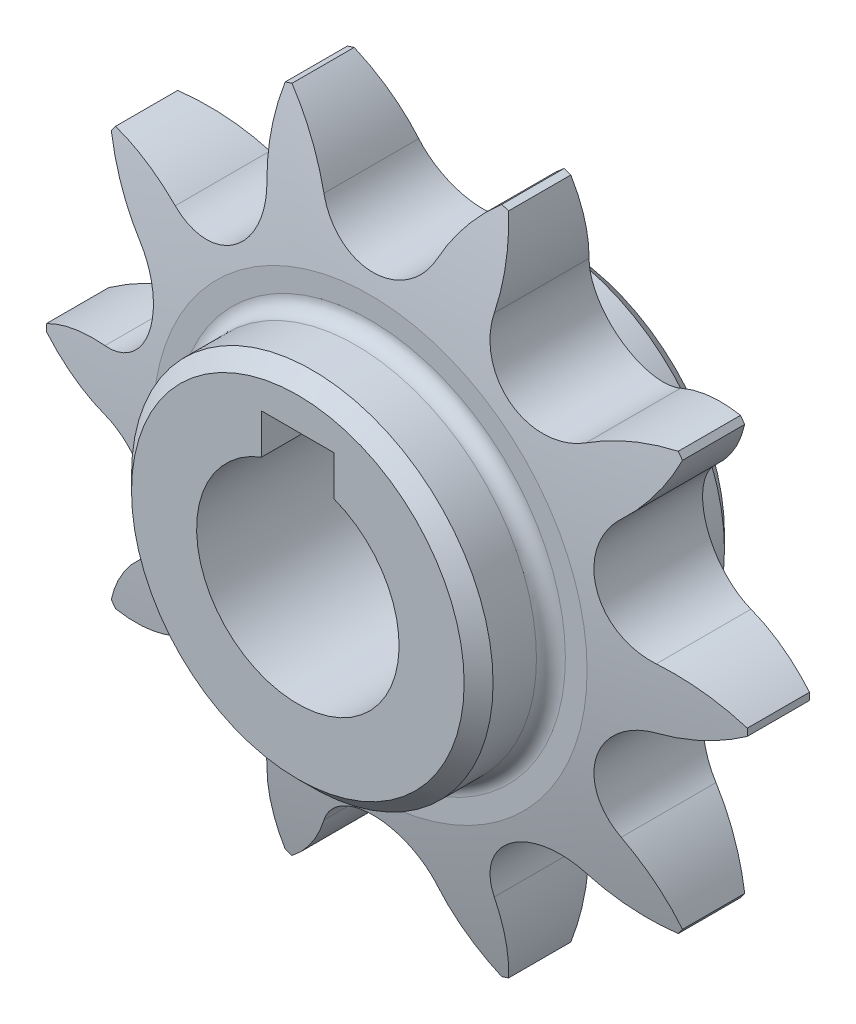
from build123d import *

# Parameters (mm, degrees)
EXTRUDE_1_DEPTH          = 4
SKETCH_3_R               = 7
CUT_EXTRUDE_1_DEPTH      = 10
SKETCH_4_R               = 12.5
SKETCH_4_R_2             = 7
EXTRUDE_2_DEPTH          = 5
EXTRUDE_START            = 5
SKETCH_8_R               = 12.5
SKETCH_8_R_2             = 7
EXTRUDE_3_DEPTH          = 5
CUT_EXTRUDE_2_DEPTH      = 35.679597208
CUT_EXTRUDE_2_DEPTH_BACK = 35.679597208
SKETCH_7_W               = 5
SKETCH_7_H               = 2.761651585
FILLET_1_R               = 1
CHAMFER_2_SIZE           = 1


with BuildPart() as part:
    # Эскиз1 → Бобышка-Вытянуть1 (new, symmetric)
    with BuildSketch(Plane.XY):
        with BuildLine():
            Line((19.747987296, 14.04222361), (19.457411946, 14.442166267))
            ThreePointArc((19.457411946, 14.442166267), (16.739084231, 13.958221812), (14.198100096, 12.877986916))
            ThreePointArc((14.198100096, 12.877986916), (9.548240137, 13.142025099), (7.860239152, 17.482712426))
            ThreePointArc((7.860239152, 17.482712426), (8.102396311, 20.233142886), (7.72264538, 22.967973234))
            Line((7.72264538, 22.967973234), (7.252484588, 23.120737736))
            ThreePointArc((7.252484588, 23.120737736), (5.337766683, 21.131425505), (3.917013477, 18.763944115))
            ThreePointArc((3.917013477, 18.763944115), (0, 16.244436388), (-3.917013477, 18.763944115))
            ThreePointArc((-3.917013477, 18.763944115), (-5.337766683, 21.131425505), (-7.252484588, 23.120737736))
            Line((-7.252484588, 23.120737736), (-7.72264538, 22.967973234))
            ThreePointArc((-7.72264538, 22.967973234), (-8.102396313, 20.233142886), (-7.860239156, 17.482712425))
            ThreePointArc((-7.860239156, 17.482712425), (-9.548240141, 13.142025102), (-14.198100096, 12.877986916))
            ThreePointArc((-14.198100096, 12.877986916), (-16.739084231, 13.958221813), (-19.457411946, 14.442166267))
            Line((-19.457411946, 14.442166267), (-19.747987296, 14.04222361))
            ThreePointArc((-19.747987296, 14.04222361), (-18.447719308, 11.606487383), (-16.635147591, 9.523678805))
            ThreePointArc((-16.635147591, 9.523678805), (-15.449377081, 5.019806908), (-19.055995054, 2.073076422))
            ThreePointArc((-19.055995054, 2.073076422), (-21.746640542, 1.45345181), (-24.230269274, 0.247178156))
            Line((-24.230269274, 0.247178156), (-24.230269274, -0.247178156))
            ThreePointArc((-24.230269274, -0.247178156), (-21.746640542, -1.45345181), (-19.055995054, -2.073076422))
            ThreePointArc((-19.055995054, -2.073076422), (-15.449377081, -5.019806908), (-16.635147591, -9.523678804))
            ThreePointArc((-16.635147591, -9.523678804), (-18.447719308, -11.606487383), (-19.747987296, -14.04222361))
            Line((-19.747987296, -14.04222361), (-19.457411946, -14.442166267))
            ThreePointArc((-19.457411946, -14.442166267), (-16.739084231, -13.958221812), (-14.198100095, -12.877986916))
            ThreePointArc((-14.198100095, -12.877986916), (-9.548240141, -13.142025102), (-7.860239156, -17.482712425))
            ThreePointArc((-7.860239156, -17.482712425), (-8.102396313, -20.233142886), (-7.72264538, -22.967973234))
            Line((-7.72264538, -22.967973234), (-7.252484588, -23.120737735))
            ThreePointArc((-7.252484588, -23.120737735), (-5.337766683, -21.131425505), (-3.917013476, -18.763944115))
            ThreePointArc((-3.917013476, -18.763944115), (0, -16.244436388), (3.917013477, -18.763944115))
            ThreePointArc((3.917013477, -18.763944115), (5.337766684, -21.131425505), (7.252484589, -23.120737735))
            Line((7.252484589, -23.120737735), (7.72264538, -22.967973234))
            ThreePointArc((7.72264538, -22.967973234), (8.102396313, -20.233142886), (7.860239156, -17.482712425))
            ThreePointArc((7.860239156, -17.482712425), (9.548240141, -13.142025102), (14.198100096, -12.877986916))
            ThreePointArc((14.198100096, -12.877986916), (16.739084231, -13.958221812), (19.457411947, -14.442166267))
            Line((19.457411947, -14.442166267), (19.747987296, -14.04222361))
            ThreePointArc((19.747987296, -14.04222361), (18.447719308, -11.606487383), (16.635147591, -9.523678804))
            ThreePointArc((16.635147591, -9.523678804), (15.449377081, -5.019806908), (19.055995054, -2.073076422))
            ThreePointArc((19.055995054, -2.073076422), (21.746640543, -1.45345181), (24.230269274, -0.247178156))
            Line((24.230269274, -0.247178156), (24.230269274, 0.247178156))
            ThreePointArc((24.230269274, 0.247178156), (21.746640542, 1.45345181), (19.055995054, 2.073076422))
            ThreePointArc((19.055995054, 2.073076422), (15.449377081, 5.019806908), (16.635147591, 9.523678805))
            ThreePointArc((16.635147591, 9.523678805), (18.447719308, 11.606487383), (19.747987296, 14.04222361))
        make_face()
    extrude(amount=EXTRUDE_1_DEPTH, both=True)

    # Эскиз3 → Вырез-Вытянуть1 (cut)
    with BuildSketch(Plane.XY.offset(4)):
        Circle(SKETCH_3_R)
    extrude(amount=-CUT_EXTRUDE_1_DEPTH, mode=Mode.SUBTRACT)

    # Эскиз4 → Бобышка-Вытянуть2 (add)
    with BuildSketch(Plane.XY.offset(-4)):
        Circle(SKETCH_4_R)
        Circle(SKETCH_4_R_2, mode=Mode.SUBTRACT)
    extrude(amount=-EXTRUDE_2_DEPTH)

    # Эскиз8 → Бобышка-Вытянуть3 (add)
    with BuildSketch(Plane.XY.offset(4).offset(EXTRUDE_START)):
        Circle(SKETCH_8_R)
        Circle(SKETCH_8_R_2, mode=Mode.SUBTRACT)
    extrude(amount=-EXTRUDE_3_DEPTH)

    # Эскиз7 → Вырез-Вытянуть2 (cut, two sides: drawn at the far end of the back side and taken through both)
    with BuildSketch(Plane.XY.offset(-CUT_EXTRUDE_2_DEPTH_BACK)):
        with Locations((0, 7.919174208)):
            Rectangle(SKETCH_7_W, SKETCH_7_H)
    extrude(amount=CUT_EXTRUDE_2_DEPTH + CUT_EXTRUDE_2_DEPTH_BACK, mode=Mode.SUBTRACT)

    # Эскиз9 → Вырез-Повернуть1 (revolve, cut)
    with BuildSketch(Plane(origin=(0, 0, 0), x_dir=(1, 0, 0), z_dir=(0, 1, 0)), mode=Mode.PRIVATE) as cut_revolve_1_sk:
        with BuildLine():
            Line((-15, -4), (-27, -4))
            Line((-27, -4), (-27, -1.41743255))
            ThreePointArc((-27, -1.41743255), (-21.039662869, -2.893011339), (-15, -4))
        make_face()
    cut_revolve_1 = revolve(cut_revolve_1_sk.sketch.rotate(Axis((0, 0, -5.923675874), (0, 0, -1)), 359.415533781), axis=Axis((0, 0, -5.923675874), (0, 0, -1)), mode=Mode.SUBTRACT)

    # Зеркальное отражение2: Вырез-Повернуть1 across plane
    add(cut_revolve_1.mirror(Plane.XY), mode=Mode.SUBTRACT)

    # Скругление1
    fillet_1_edges = [part.edges().sort_by_distance(p)[0] for p in [
        (-12.5, 0, -4),
        (-12.5, 0, 4),
    ]]
    fillet(fillet_1_edges, radius=FILLET_1_R)

    # Фаска2
    chamfer_2_edges = [part.edges().sort_by_distance(p)[0] for p in [
        (-12.5, 0, -9),
        (-12.5, 0, 9),
    ]]
    chamfer(chamfer_2_edges, length=CHAMFER_2_SIZE)


solid = part.part
